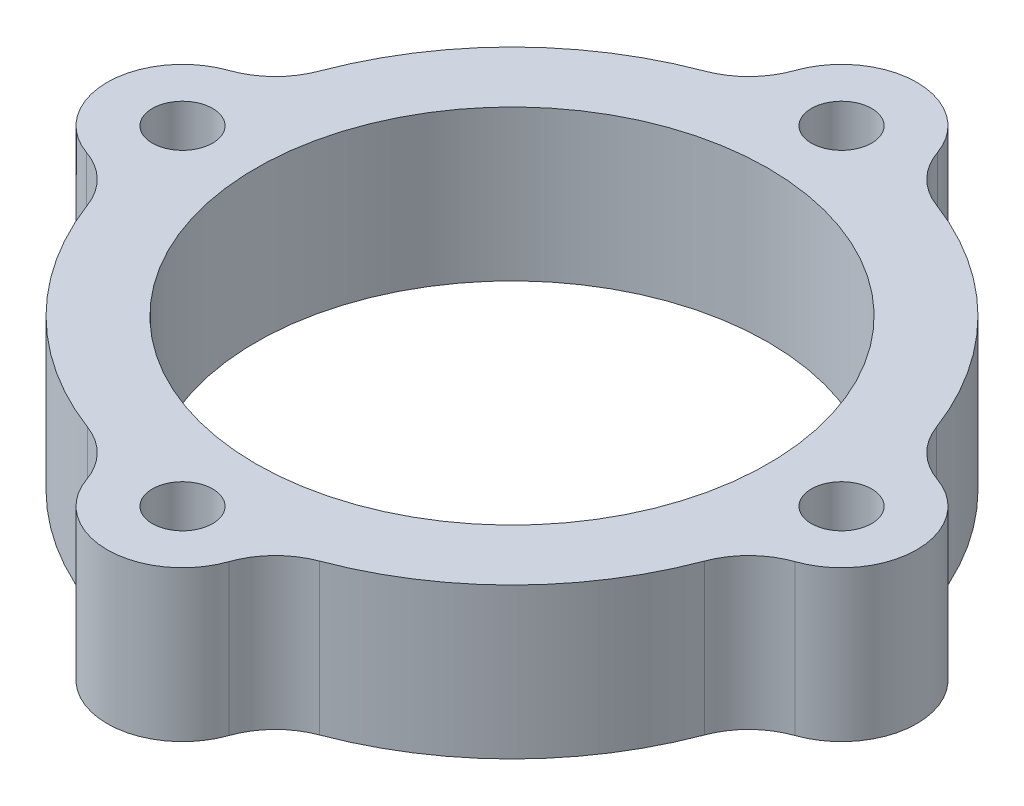
from build123d import *

# Parameters (mm, degrees)
SKETCH_1_R      = 1.6
SKETCH_1_R_2    = 13.6
EXTRUDE_1_DEPTH = 8
FILLET_1_R      = 4


with BuildPart() as part:
    # ｽｹｯﾁ1 → ﾎﾞｽ - 押し出し1 (new body)
    with BuildSketch(Plane(origin=(0, 0, 0), x_dir=(1, 0, 0), z_dir=(0, 1, 0))):
        with BuildLine():
            ThreePointArc((17.042857143, 3.973791692), (12.374368671, 12.374368671), (3.973791692, 17.042857143))
            ThreePointArc((3.973791692, 17.042857143), (0, 21.5), (-3.973791692, 17.042857143))
            ThreePointArc((-3.973791692, 17.042857143), (-12.374368671, 12.374368671), (-17.042857143, 3.973791692))
            ThreePointArc((-17.042857143, 3.973791692), (-21.5, 0), (-17.042857143, -3.973791692))
            ThreePointArc((-17.042857143, -3.973791692), (-12.374368671, -12.374368671), (-3.973791692, -17.042857143))
            ThreePointArc((-3.973791692, -17.042857143), (0, -21.5), (3.973791692, -17.042857143))
            ThreePointArc((3.973791692, -17.042857143), (12.374368671, -12.374368671), (17.042857143, -3.973791692))
            ThreePointArc((17.042857143, -3.973791692), (21.5, 0), (17.042857143, 3.973791692))
        make_face()
        with Locations((17.5, 0)):
            Circle(SKETCH_1_R, mode=Mode.SUBTRACT)
        Circle(SKETCH_1_R_2, mode=Mode.SUBTRACT)
        with Locations((0, -17.5)):
            Circle(SKETCH_1_R, mode=Mode.SUBTRACT)
        with Locations((0, 17.5)):
            Circle(SKETCH_1_R, mode=Mode.SUBTRACT)
        with Locations((-17.5, 0)):
            Circle(SKETCH_1_R, mode=Mode.SUBTRACT)
    extrude(amount=EXTRUDE_1_DEPTH)

    # ﾌｨﾚｯﾄ1
    fillet_1_edges = [part.edges().sort_by_distance(p)[0] for p in [
        (-17.042857143, 4, 3.973791692),
        (-3.973791692, 4, 17.042857143),
        (3.973791692, 4, 17.042857143),
        (17.042857143, 4, 3.973791692),
        (17.042857143, 4, -3.973791692),
        (3.973791692, 4, -17.042857143),
        (-17.042857143, 4, -3.973791692),
        (-3.973791692, 4, -17.042857143),
    ]]
    fillet(fillet_1_edges, radius=FILLET_1_R)


solid = part.part
